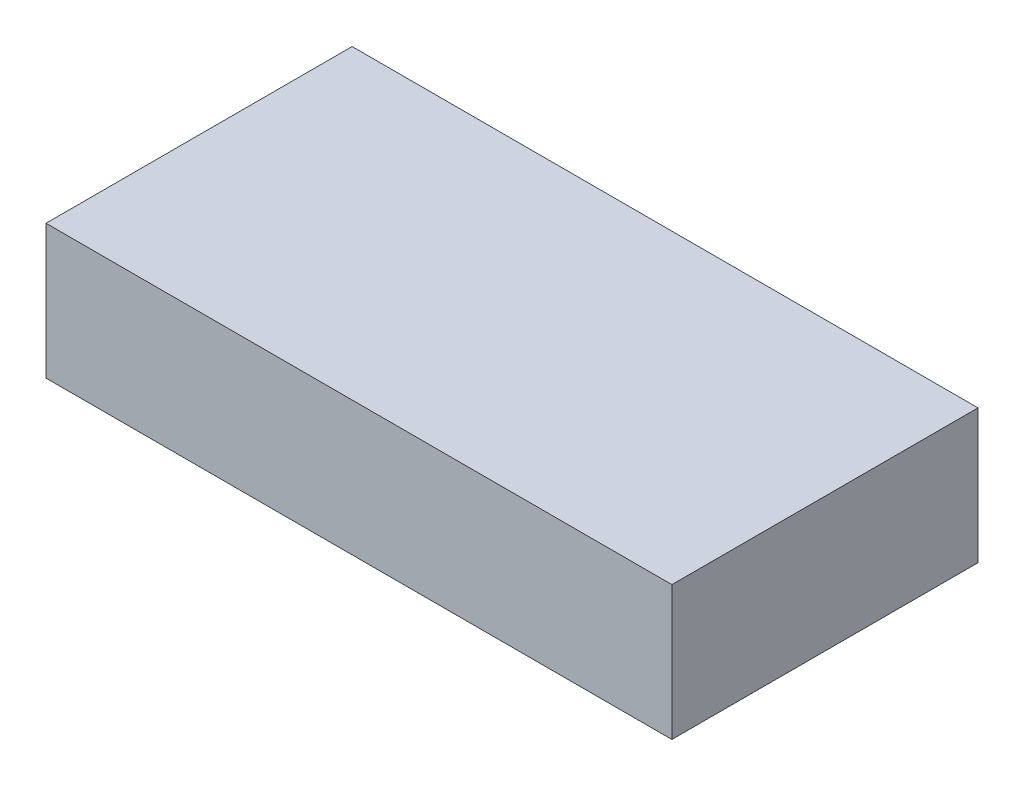
from build123d import *

# Parameters (mm, degrees)
SKETCH2_W           = 70
SKETCH2_H           = 34.236760125
BOSS_EXTRUDE1_DEPTH = 15


with BuildPart() as part:
    # Sketch2 → Boss-Extrude1 (new body)
    with BuildSketch(Plane(origin=(0, 0, 0), x_dir=(1, 0, 0), z_dir=(0, 1, 0))):
        with Locations((35, 17.118380063)):
            Rectangle(SKETCH2_W, SKETCH2_H)
    extrude(amount=BOSS_EXTRUDE1_DEPTH)


solid = part.part
